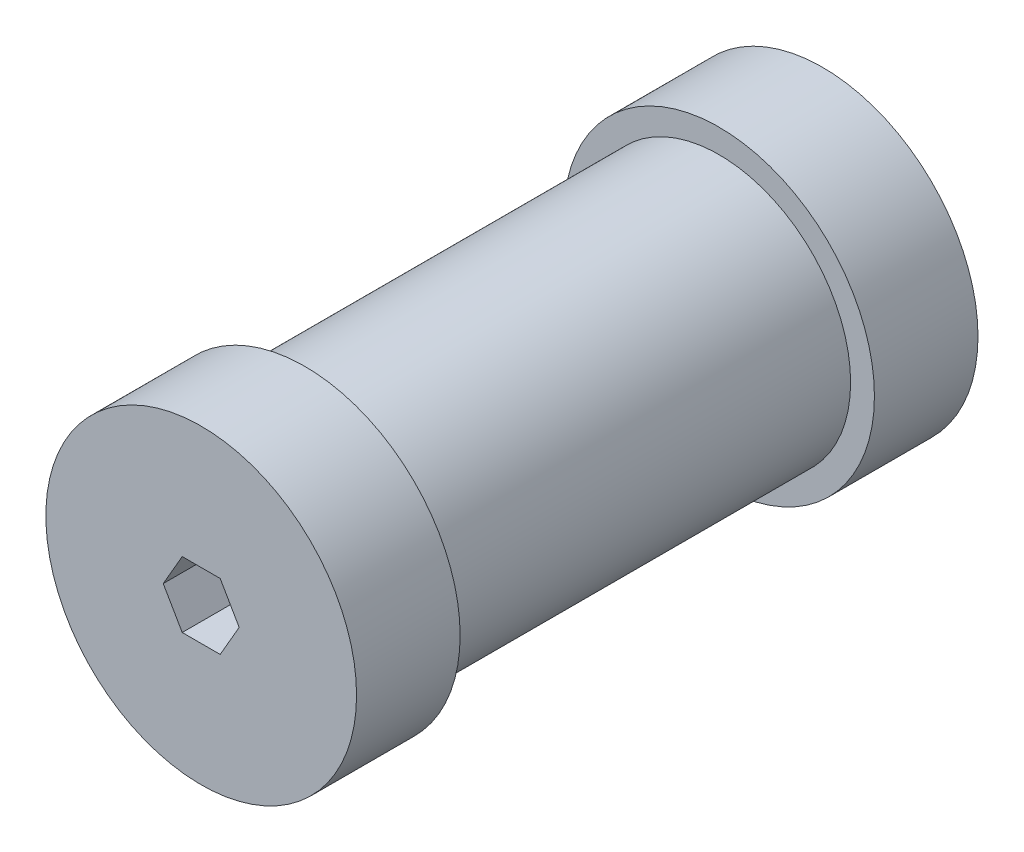
from build123d import *

# Parameters (mm, degrees)
CORTAR_EXTRUIR1_DEPTH = 128.279220614


with BuildPart() as part:
    # Croquis1 → Revolución1 (revolve)
    with BuildSketch(Plane(origin=(0, 0, 0), x_dir=(1, 0, 0), z_dir=(0, 1, 0)), mode=Mode.PRIVATE) as revoluci_n1_sk:
        Polygon((0, 55.393258427), (-30, 55.393258427), (-30, 35.393258427), (-25.4, 35.393258427), (-25.4, -44.606741573), (-30, -44.606741573), (-30, -64.606741573), (0, -64.606741573), align=None)
    revolve(revoluci_n1_sk.sketch.rotate(Axis((0, 0, 64.606741573), (0, 0, -1)), 180), axis=Axis((0, 0, 64.606741573), (0, 0, -1)))

    # Croquis2 → Cortar-Extruir1 (cut, through all)
    with BuildSketch(Plane(origin=(0, 0, -55.393258427), x_dir=(-1, 0, 0), z_dir=(0, 0, -1))):
        Polygon((7.332348419, 0), (3.666174209, 6.35), (-3.666174209, 6.35), (-7.332348419, 0), (-3.666174209, -6.35), (3.666174209, -6.35), align=None)
    extrude(amount=-CORTAR_EXTRUIR1_DEPTH, mode=Mode.SUBTRACT)


solid = part.part
